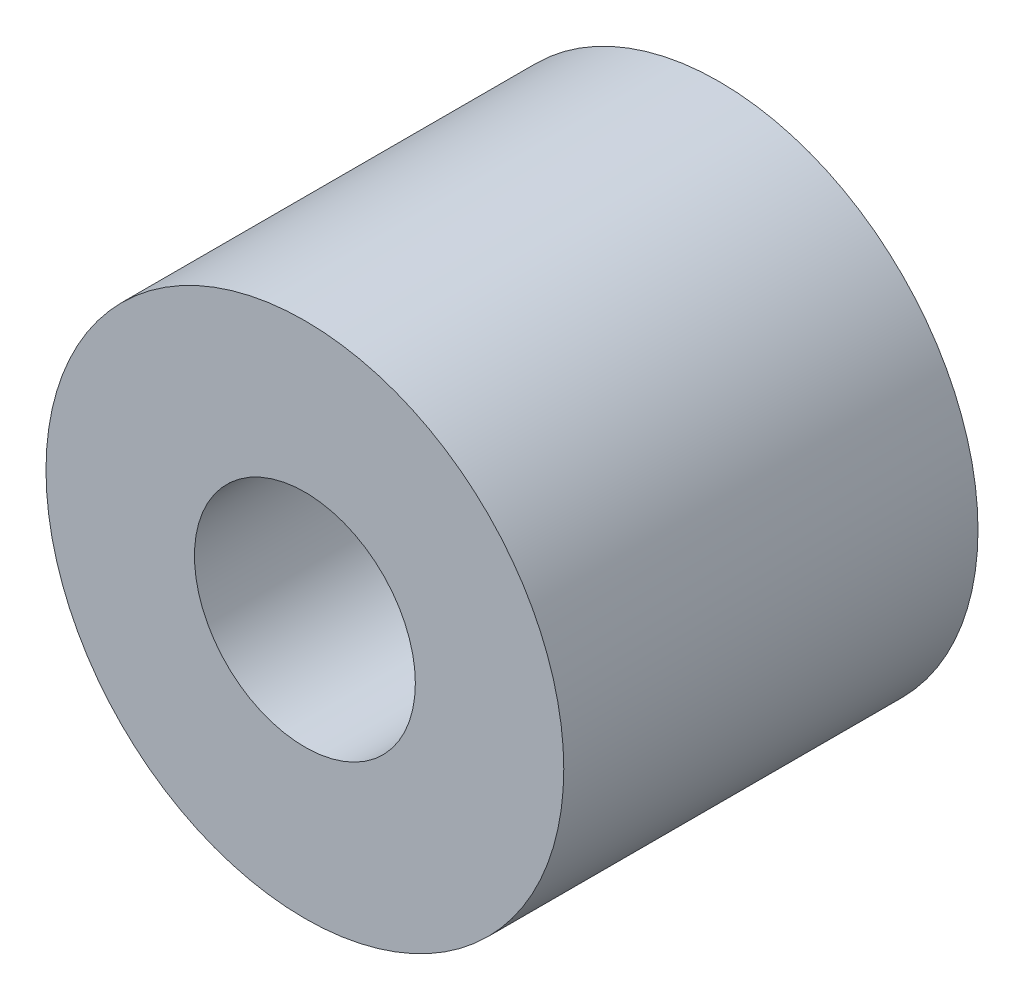
from build123d import *

# Parameters (mm, degrees)
SKETCH_1_R      = 7.5
SKETCH_1_R_2    = 3.2
EXTRUDE_1_DEPTH = 12


with BuildPart() as part:
    # 스케치1 → 보스-돌출1 (new body)
    with BuildSketch(Plane.XY):
        Circle(SKETCH_1_R)
        Circle(SKETCH_1_R_2, mode=Mode.SUBTRACT)
    extrude(amount=EXTRUDE_1_DEPTH)


solid = part.part
